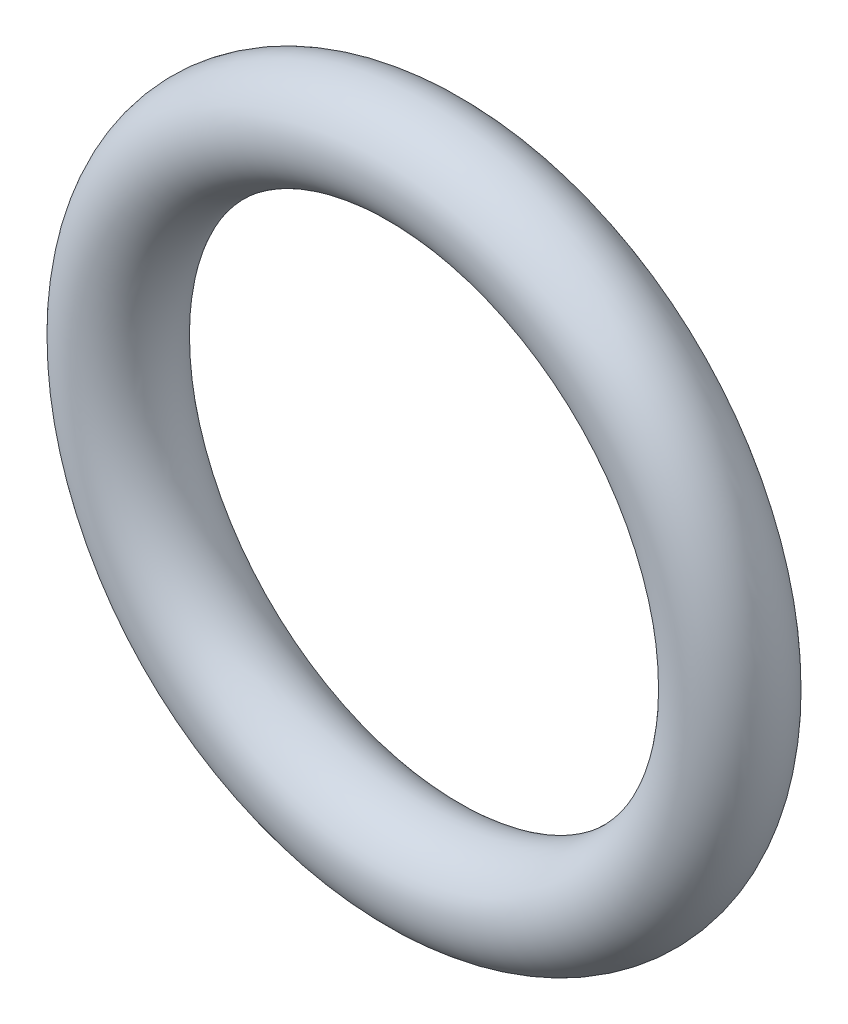
from build123d import *

# Parameters (mm, degrees)
SKETCH2_R = 0.762


with BuildPart() as part:
    # Base-Sweep: sweep along a path in Sketch1
    with BuildLine(Plane.XY) as base_sweep_path:
        CenterArc((0, 0), 4.6228, 0, 360)
    # Sketch2 → Base-Sweep (sweep)
    with BuildSketch(Plane(origin=(0, 0, 0), x_dir=(1, 0, 0), z_dir=(0, 1, 0))):
        with Locations((4.6228, 0)):
            Circle(SKETCH2_R)
    sweep(path=base_sweep_path.line)


solid = part.part
